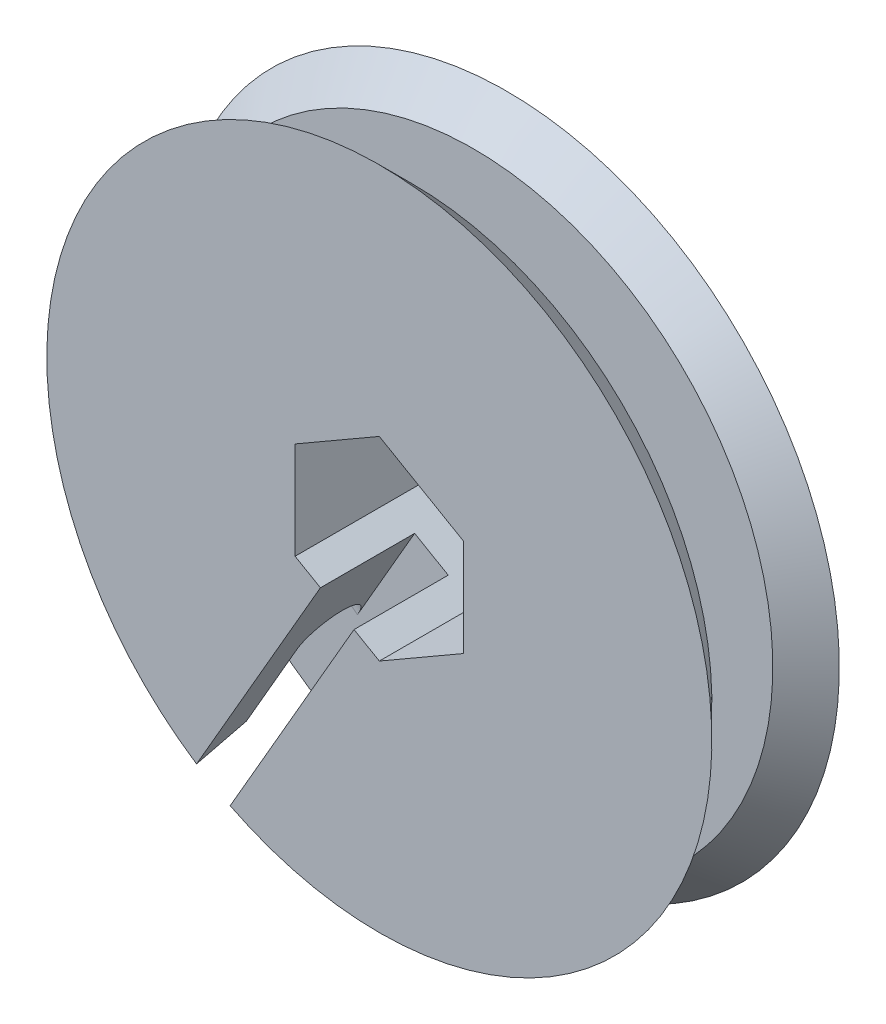
from build123d import *

# Parameters (mm, degrees)
ENL_V_MAT_EXTRU_1_DEPTH = 44.957365708
ENL_V_MAT_EXTRU_2_REACH = 45.957


with BuildPart() as part:
    # Esquisse1 → Révolution1 (revolve)
    with BuildSketch(Plane(origin=(0, 0, 0), x_dir=(-1, 0, 0), z_dir=(0, 1, 0))):
        with BuildLine():
            Line((0, 11.5), (0, 0))
            Line((0, 0), (30, 0))
            Line((30, 0), (27, 3))
            Line((27, 3), (18, 3))
            ThreePointArc((18, 3), (15.25, 5.75), (18, 8.5))
            Line((18, 8.5), (27, 8.5))
            Line((27, 8.5), (30, 11.5))
            Line((30, 11.5), (0, 11.5))
        make_face()
    revolve(axis=Axis((0, 0, 0), (0, 0, 1)))

    # Esquisse2 → Enlèv. mat.-Extru.1 (cut, through all)
    with BuildSketch(Plane(origin=(0, 0, 0), x_dir=(1, 0, 0), z_dir=(0, 0, -1))):
        Polygon((7.6, 4.387862046), (0, 8.775724092), (-7.6, 4.387862046), (-7.6, -4.387862046), (0, -8.775724092), (7.6, -4.387862046), align=None)
    extrude(amount=-ENL_V_MAT_EXTRU_1_DEPTH, mode=Mode.SUBTRACT)

    # Enlèv. mat.-Extru.2: up to this face of the body (flat: up to its plane)
    enl_v_mat_extru_2_end = Plane(part.part.faces().sort_by_distance((26.236324676, 0, 3))[0])
    # Esquisse3 → Enlèv. mat.-Extru.2 (cut, up to the picked face)
    with BuildSketch(Plane.XY.offset(11.5), mode=Mode.PRIVATE) as enl_v_mat_extru_2_sk1:
        Polygon((-14.784455543, -29.107428163), (-17.815544457, -27.357428163), (-5.315544457, -5.706793069), (-2.284455543, -7.456793069), align=None)
    enl_v_mat_extru_2_tool1 = split(extrude(enl_v_mat_extru_2_sk1.sketch, amount=-ENL_V_MAT_EXTRU_2_REACH, mode=Mode.PRIVATE), bisect_by=enl_v_mat_extru_2_end, keep=Keep.BOTH, mode=Mode.PRIVATE)
    add(enl_v_mat_extru_2_tool1.solids().sort_by(Axis((-10.05, -17.407111, 11.5), (0, 0, -1)))[0], mode=Mode.SUBTRACT)


solid = part.part
